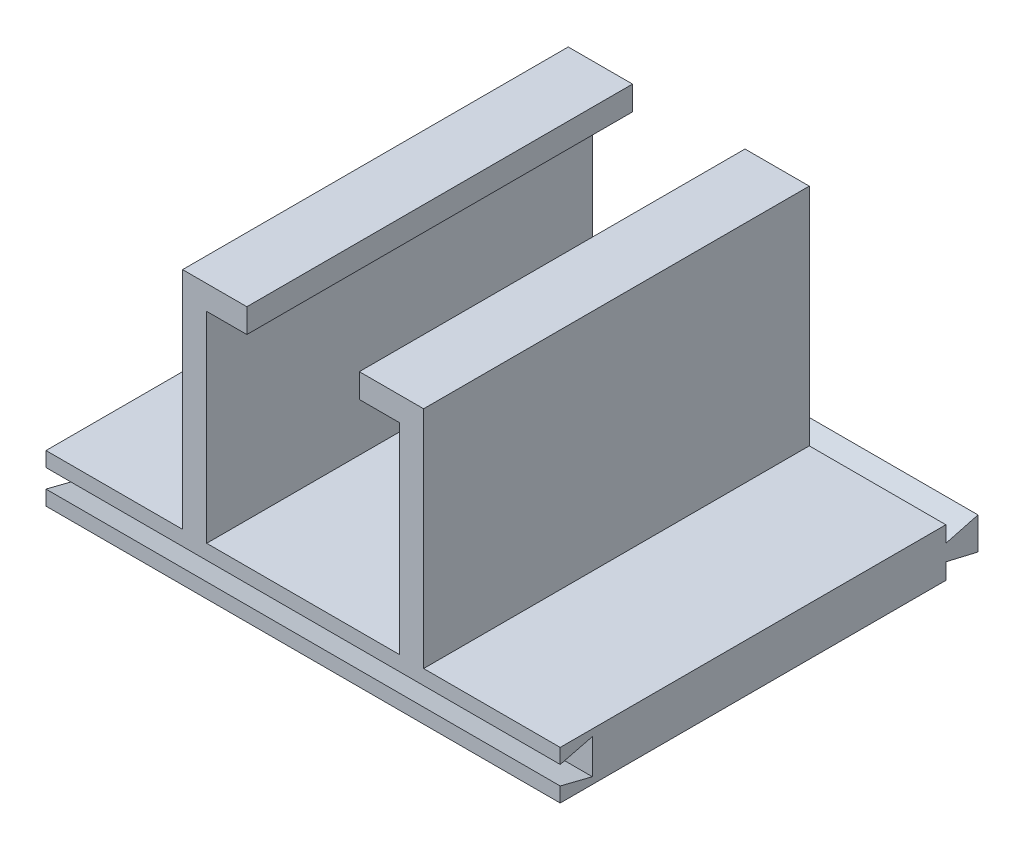
from build123d import *

# Parameters (mm, degrees)
SKETCH1_W           = 101.6
SKETCH1_H           = 76.2
BOSS_EXTRUDE1_DEPTH = 9.525
SKETCH2_W           = 4.7625
SKETCH2_H           = 76.2
BOSS_EXTRUDE2_DEPTH = 44.45
SKETCH3_W           = 76.2
SKETCH3_H           = 4.7625
BOSS_EXTRUDE3_DEPTH = 7.9375
BOSS_EXTRUDE4_DEPTH = 101.6
CUT_EXTRUDE1_DEPTH  = 142.599304818


with BuildPart() as part:
    # Sketch1 → Boss-Extrude1 (new body)
    with BuildSketch(Plane(origin=(0, 0, 0), x_dir=(1, 0, 0), z_dir=(0, 1, 0))):
        with Locations((50.8, 38.1)):
            Rectangle(SKETCH1_W, SKETCH1_H)
    extrude(amount=BOSS_EXTRUDE1_DEPTH)

    # Sketch2 → Boss-Extrude2 (add)
    with BuildSketch(Plane(origin=(0, 9.525, 0), x_dir=(1, 0, 0), z_dir=(0, 1, 0))):
        with Locations((29.36875, 38.1)):
            Rectangle(SKETCH2_W, SKETCH2_H)
    boss_extrude2 = extrude(amount=BOSS_EXTRUDE2_DEPTH)

    # Sketch3 → Boss-Extrude3 (add)
    with BuildSketch(Plane(origin=(31.75, 0, 0), x_dir=(0, 0, -1), z_dir=(1, 0, 0))):
        with Locations((38.1, 51.59375)):
            Rectangle(SKETCH3_W, SKETCH3_H)
    boss_extrude3 = extrude(amount=BOSS_EXTRUDE3_DEPTH)

    # Mirror1: Boss-Extrude2, Boss-Extrude3 across plane
    add(boss_extrude2.mirror(Plane(origin=(50.8, 0, 0), x_dir=(0, 0, 1), z_dir=(1, 0, 0))))
    add(boss_extrude3.mirror(Plane(origin=(50.8, 0, 0), x_dir=(0, 0, 1), z_dir=(1, 0, 0))))

    # Sketch7 → Boss-Extrude4 (add)
    with BuildSketch(Plane(origin=(101.6, 0, 0), x_dir=(0, 0, -1), z_dir=(1, 0, 0))):
        Polygon((76.2, 3.175), (76.2, 6.35), (82.55, 8.03294256), (82.55, 1.682230673), align=None)
    extrude(amount=-BOSS_EXTRUDE4_DEPTH)

    # Sketch9 → Cut-Extrude1 (cut, through all)
    with BuildSketch(Plane(origin=(101.6, 0, 0), x_dir=(0, 0, -1), z_dir=(1, 0, 0))):
        Polygon((0, 2.921), (0, 6.604), (6.35, 8.1915), (6.35, 1.3335), align=None)
    extrude(amount=-CUT_EXTRUDE1_DEPTH, mode=Mode.SUBTRACT)


solid = part.part
